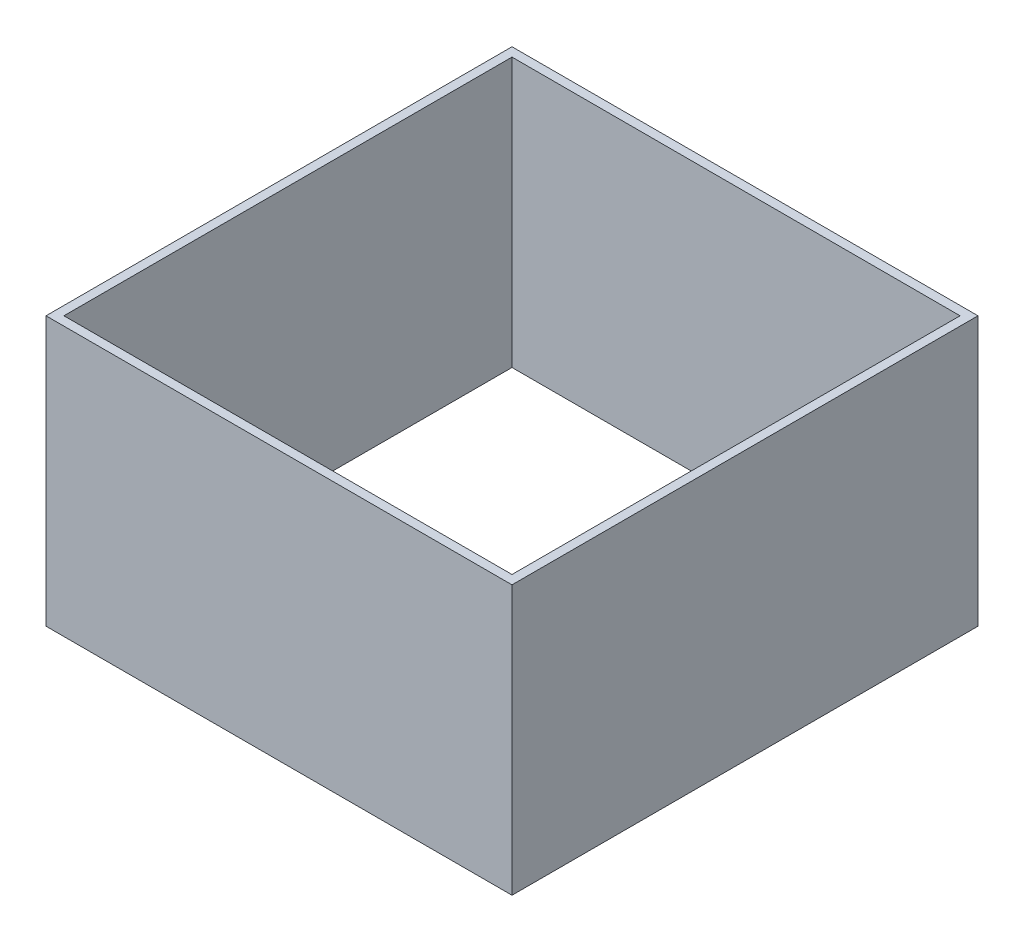
from build123d import *

# Parameters (mm, degrees)
SKETCH1_W           = 52
SKETCH1_H           = 52
SKETCH1_W_2         = 50
SKETCH1_H_2         = 50
BOSS_EXTRUDE1_DEPTH = 30


with BuildPart() as part:
    # Sketch1 → Boss-Extrude1 (new body)
    with BuildSketch(Plane(origin=(0, 0, 0), x_dir=(1, 0, 0), z_dir=(0, 1, 0))):
        with Locations((26, 26)):
            Rectangle(SKETCH1_W, SKETCH1_H)
        with Locations((26, 26)):
            Rectangle(SKETCH1_W_2, SKETCH1_H_2, mode=Mode.SUBTRACT)
    extrude(amount=BOSS_EXTRUDE1_DEPTH)


solid = part.part
